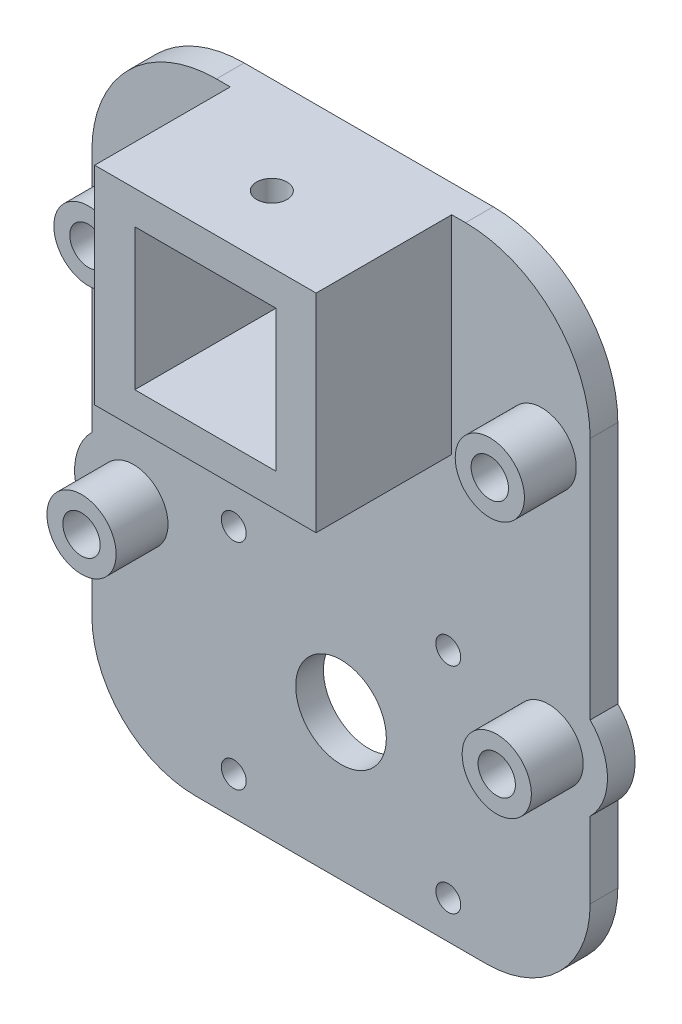
from build123d import *

# Parameters (mm, degrees)
SKETCH_1_R          = 1.8
SKETCH_1_R_2        = 6.55
SKETCH_1_R_3        = 2.7
SKETCH_1_W          = 20.4
SKETCH_1_H          = 20.4
EXTRUDE_1_DEPTH     = 4
EXTRUDE_START       = 4
SKETCH_1_4_W        = 32
SKETCH_1_4_H        = 30
SKETCH_1_4_W_2      = 20.4
SKETCH_1_4_H_2      = 20.4
SKETCH_1_4_R        = 1.6
EXTRUDE_3_DEPTH     = 19.6
CUT_EXTRUDE_4_REACH = 103.812
SKETCH_8_R          = 2.2
SKETCH_9_R          = 5
SKETCH_9_R_2        = 2.7
EXTRUDE_4_DEPTH     = 7.5


with BuildPart() as part:
    # 草图1 → 凸台-拉伸1 (new body)
    with BuildSketch(Plane.XY):
        with BuildLine():
            ThreePointArc((-36, -25.5), (-31.606601718, -36.106601718), (-21, -40.5))
            Line((-21, -40.5), (21, -40.5))
            ThreePointArc((21, -40.5), (31.606601718, -36.106601718), (36, -25.5))
            Line((36, -25.5), (36, -14.520797289))
            ThreePointArc((36, -14.520797289), (38.5, -8.5), (36, -2.479202711))
            Line((36, -2.479202711), (36, 32.75))
            ThreePointArc((36, 32.75), (30.727922061, 45.477922061), (18, 50.75))
            Line((18, 50.75), (-18, 50.75))
            ThreePointArc((-18, 50.75), (-30.727922061, 45.477922061), (-36, 32.75))
            Line((-36, 32.75), (-36, -2.479202711))
            ThreePointArc((-36, -2.479202711), (-38.5, -8.5), (-36, -14.520797289))
            Line((-36, -14.520797289), (-36, -25.5))
        make_face()
        with Locations((15.5, -35)):
            Circle(SKETCH_1_R, mode=Mode.SUBTRACT)
        with Locations((0, -19.5)):
            Circle(SKETCH_1_R_2, mode=Mode.SUBTRACT)
        with Locations((15.5, -4)):
            Circle(SKETCH_1_R, mode=Mode.SUBTRACT)
        with Locations((-15.5, -35)):
            Circle(SKETCH_1_R, mode=Mode.SUBTRACT)
        with Locations((-15.5, -4)):
            Circle(SKETCH_1_R, mode=Mode.SUBTRACT)
        with Locations((-30, -8.5)):
            Circle(SKETCH_1_R_3, mode=Mode.SUBTRACT)
        with Locations((30, -8.5)):
            Circle(SKETCH_1_R_3, mode=Mode.SUBTRACT)
        with Locations((-29, 28.1)):
            Circle(SKETCH_1_R_3, mode=Mode.SUBTRACT)
        with Locations((29, 28.1)):
            Circle(SKETCH_1_R_3, mode=Mode.SUBTRACT)
        with Locations((0, 35.75)):
            Rectangle(SKETCH_1_W, SKETCH_1_H, mode=Mode.SUBTRACT)
    extrude(amount=EXTRUDE_1_DEPTH)

    # 草图1<4> → 凸台-拉伸3 (add)
    # profile 1 of 3: a face of its own
    with BuildSketch(Plane.XY.offset(EXTRUDE_START)):
        with Locations((0, 35.75)):
            Rectangle(SKETCH_1_4_W, SKETCH_1_4_H)
        with Locations((0, 35.75)):
            Rectangle(SKETCH_1_4_W_2, SKETCH_1_4_H_2, mode=Mode.SUBTRACT)
    # profile 2 of 3: a face of its own
    with BuildSketch(Plane.XY.offset(EXTRUDE_START)):
        with Locations((-13.2, 35.75)):
            Circle(SKETCH_1_4_R)
    # profile 3 of 3: a face of its own
    with BuildSketch(Plane.XY.offset(EXTRUDE_START)):
        with Locations((13.2, 35.75)):
            Circle(SKETCH_1_4_R)
    extrude(amount=EXTRUDE_3_DEPTH)

    # 草图8 → 切除-拉伸4 (cut, up to next)
    with BuildSketch(Plane(origin=(0, 50.75, 0), x_dir=(1, 0, 0), z_dir=(0, 1, 0)), mode=Mode.PRIVATE) as cut_extrude_4_sk1:
        with Locations(Location((0, -14, 0), (0, 0, 270))):
            Circle(SKETCH_8_R)
    cut_extrude_4_tool1 = extrude(cut_extrude_4_sk1.sketch, amount=-CUT_EXTRUDE_4_REACH, mode=Mode.PRIVATE) & part.part
    add(cut_extrude_4_tool1.solids().sort_by_distance((0, 50.75, 14))[0], mode=Mode.SUBTRACT)

    # 草图9 → 凸台-拉伸4 (add)
    # profile 1 of 4: a face of its own
    with BuildSketch(Plane.XY.offset(4)):
        with Locations((-29, 28.1)):
            Circle(SKETCH_9_R)
        with Locations((-29, 28.1)):
            Circle(SKETCH_9_R_2, mode=Mode.SUBTRACT)
    # profile 2 of 4: a face of its own
    with BuildSketch(Plane.XY.offset(4)):
        with Locations((-30, -8.5)):
            Circle(SKETCH_9_R)
        with Locations((-30, -8.5)):
            Circle(SKETCH_9_R_2, mode=Mode.SUBTRACT)
    # profile 3 of 4: a face of its own
    with BuildSketch(Plane.XY.offset(4)):
        with Locations(Location((30, -8.5, 0), (0, 0, 180))):
            Circle(SKETCH_9_R)
        with Locations(Location((30, -8.5, 0), (0, 0, 180))):
            Circle(SKETCH_9_R_2, mode=Mode.SUBTRACT)
    # profile 4 of 4: a face of its own
    with BuildSketch(Plane.XY.offset(4)):
        with Locations(Location((29, 28.1, 0), (0, 0, 180))):
            Circle(SKETCH_9_R)
        with Locations(Location((29, 28.1, 0), (0, 0, 180))):
            Circle(SKETCH_9_R_2, mode=Mode.SUBTRACT)
    extrude(amount=EXTRUDE_4_DEPTH)


solid = part.part
